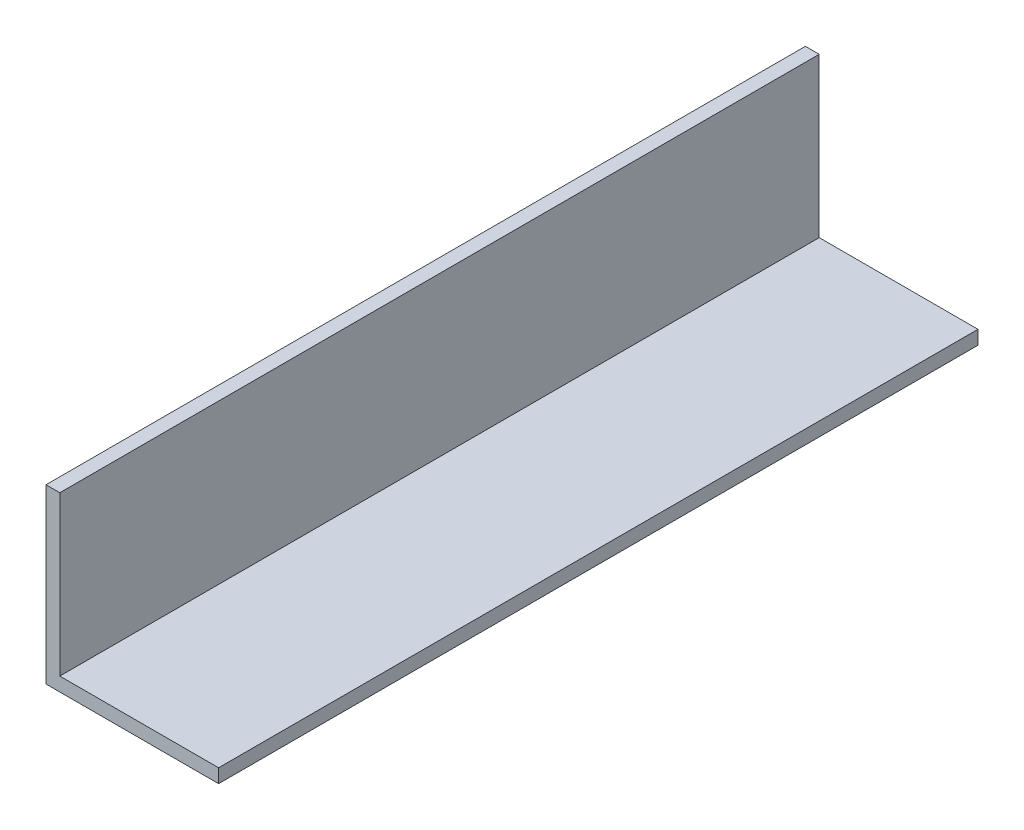
from build123d import *

# Parameters (mm, degrees)
BOSS_EXTRUDE1_DEPTH = 110


with BuildPart() as part:
    # Sketch1 → Boss-Extrude1 (new body)
    with BuildSketch(Plane.XY):
        Polygon((0, 0), (25, 0), (25, 2), (2, 2), (2, 25), (0, 25), align=None)
    extrude(amount=BOSS_EXTRUDE1_DEPTH)


solid = part.part
